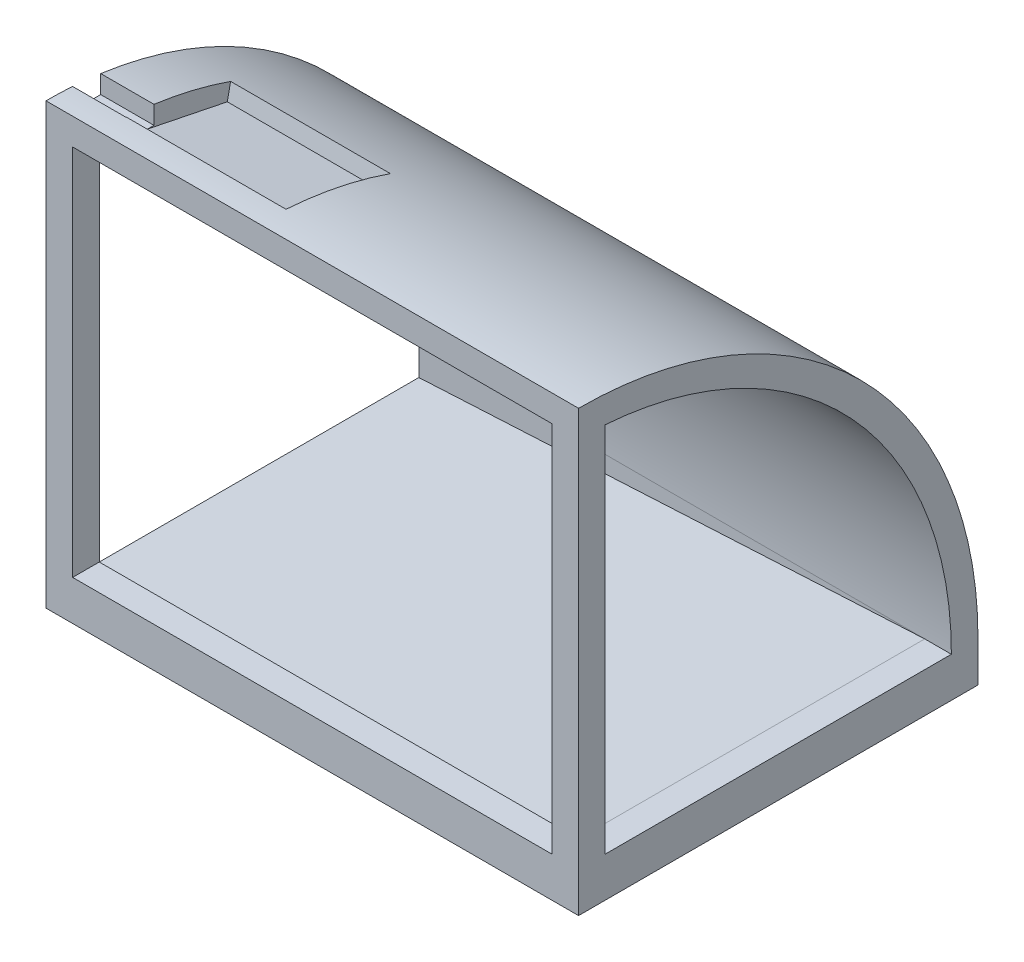
from build123d import *

# Parameters (mm, degrees)
SKETCH1_W                = 200
SKETCH1_H                = 150
BOSS_EXTRUDE1_DEPTH      = 15
SKETCH1_5_W              = 200
SKETCH1_5_H              = 10
REVOLVE1_ANGLE           = 90
BOSS_EXTRUDE3_REACH      = 197.256
BOSS_EXTRUDE3_END_RADIUS = 140
SKETCH1_6_W              = 10
SKETCH1_6_H              = 10
CUT_EXTRUDE1_DEPTH       = 130
CUT_EXTRUDE2_DEPTH       = 60
SKETCH7_W                = 10.545965087
SKETCH7_H                = 8.248079899
CUT_EXTRUDE5_DEPTH       = 74


with BuildPart() as part:
    # Sketch1 → Boss-Extrude1 (new body)
    with BuildSketch(Plane(origin=(0, 0, 0), x_dir=(1, 0, 0), z_dir=(0, 1, 0))):
        Rectangle(SKETCH1_W, SKETCH1_H)
    extrude(amount=-BOSS_EXTRUDE1_DEPTH)

    # Sketch1<5> → Revolve1 (revolve)
    with BuildSketch(Plane(origin=(0, 0, 0), x_dir=(1, 0, 0), z_dir=(0, 1, 0))):
        with Locations((0, 70)):
            Rectangle(SKETCH1_5_W, SKETCH1_5_H)
    revolve(axis=Axis((-100, 0, 75), (1, 0, 0)), revolution_arc=REVOLVE1_ANGLE)

    # Boss-Extrude3: up to this cylinder (the profile starts inside it)
    boss_extrude3_end = Plane(origin=(0, 0, 75), z_dir=(-1, 0, 0)) * Cylinder(BOSS_EXTRUDE3_END_RADIUS, 865.512, mode=Mode.PRIVATE)
    # Sketch1<6> → Boss-Extrude3 (add, up to the surface)
    with BuildSketch(Plane(origin=(0, 0, 0), x_dir=(1, 0, 0), z_dir=(0, 1, 0)), mode=Mode.PRIVATE) as boss_extrude3_sk1:
        with Locations((-95, -70)):
            Rectangle(SKETCH1_6_W, SKETCH1_6_H)
    boss_extrude3_tool1 = extrude(boss_extrude3_sk1.sketch, amount=BOSS_EXTRUDE3_REACH, mode=Mode.PRIVATE) & boss_extrude3_end
    add(boss_extrude3_tool1.solids().sort_by_distance((-95, 0, 70))[0])
    # Sketch1<6> → Boss-Extrude3 (add, up to the surface)
    with BuildSketch(Plane(origin=(0, 0, 0), x_dir=(1, 0, 0), z_dir=(0, 1, 0)), mode=Mode.PRIVATE) as boss_extrude3_sk2:
        with Locations((95, -70)):
            Rectangle(SKETCH1_6_W, SKETCH1_6_H)
    boss_extrude3_tool2 = extrude(boss_extrude3_sk2.sketch, amount=BOSS_EXTRUDE3_REACH, mode=Mode.PRIVATE) & boss_extrude3_end
    add(boss_extrude3_tool2.solids().sort_by_distance((95, 0, 70))[0])

    # Sketch4 → Cut-Extrude1 (cut)
    with BuildSketch(Plane.XY.offset(65)):
        Polygon((-100, -10), (90, 0), (-100, 0), align=None)
    extrude(amount=-CUT_EXTRUDE1_DEPTH, mode=Mode.SUBTRACT)

    # Sketch5 → Cut-Extrude2 (cut)
    with BuildSketch(Plane.ZY.offset(80)):
        Polygon((66.095917942, 143.620915339), (26.904082058, 135.620915339), (21.904082058, 160.115812766), (61.095917942, 168.115812766), align=None)
    extrude(amount=-CUT_EXTRUDE2_DEPTH, mode=Mode.SUBTRACT)

    # Sketch7 → Cut-Extrude5 (cut)
    with BuildSketch(Plane.ZY.offset(80)):
        with Locations((59.727017457, 145.87596005)):
            Rectangle(SKETCH7_W, SKETCH7_H)
    extrude(amount=CUT_EXTRUDE5_DEPTH, mode=Mode.SUBTRACT)


solid = part.part
